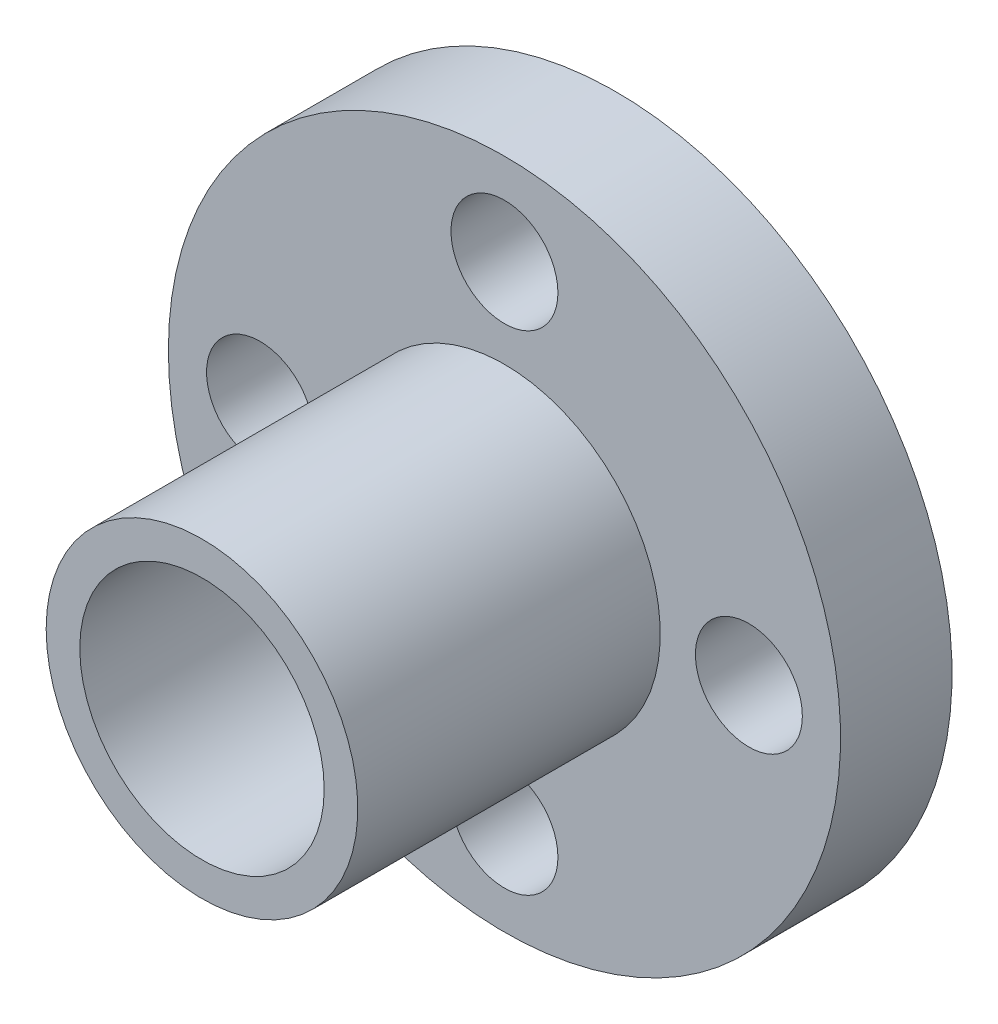
from build123d import *

# Parameters (mm, degrees)
F_3_5_3_5_DIAMETER_HOLE1_D = 3.5


with BuildPart() as part:
    # Sketch1 → Revolve1 (revolve)
    with BuildSketch(Plane(origin=(0, 0, 0), x_dir=(1, 0, 0), z_dir=(0, 1, 0)), mode=Mode.PRIVATE) as revolve1_sk:
        Polygon((11, -1.5), (11, -5.15), (5.1, -5.15), (5.1, -15.05), (4, -15.05), (4, 0), (5.1, 0), (5.1, -1.5), align=None)
    revolve(revolve1_sk.sketch.rotate(Axis((0, 0, 0), (0, 0, 1)), 180), axis=Axis((0, 0, 0), (0, 0, 1)))

    # Ø3.5 (3.5) Diameter Hole1 (through all)
    with Locations(Plane.XY.offset(5.15)):
        with Locations((-8, 0), (0, 8), (8, 0), (0, -8)):
            Hole(F_3_5_3_5_DIAMETER_HOLE1_D / 2)


solid = part.part
